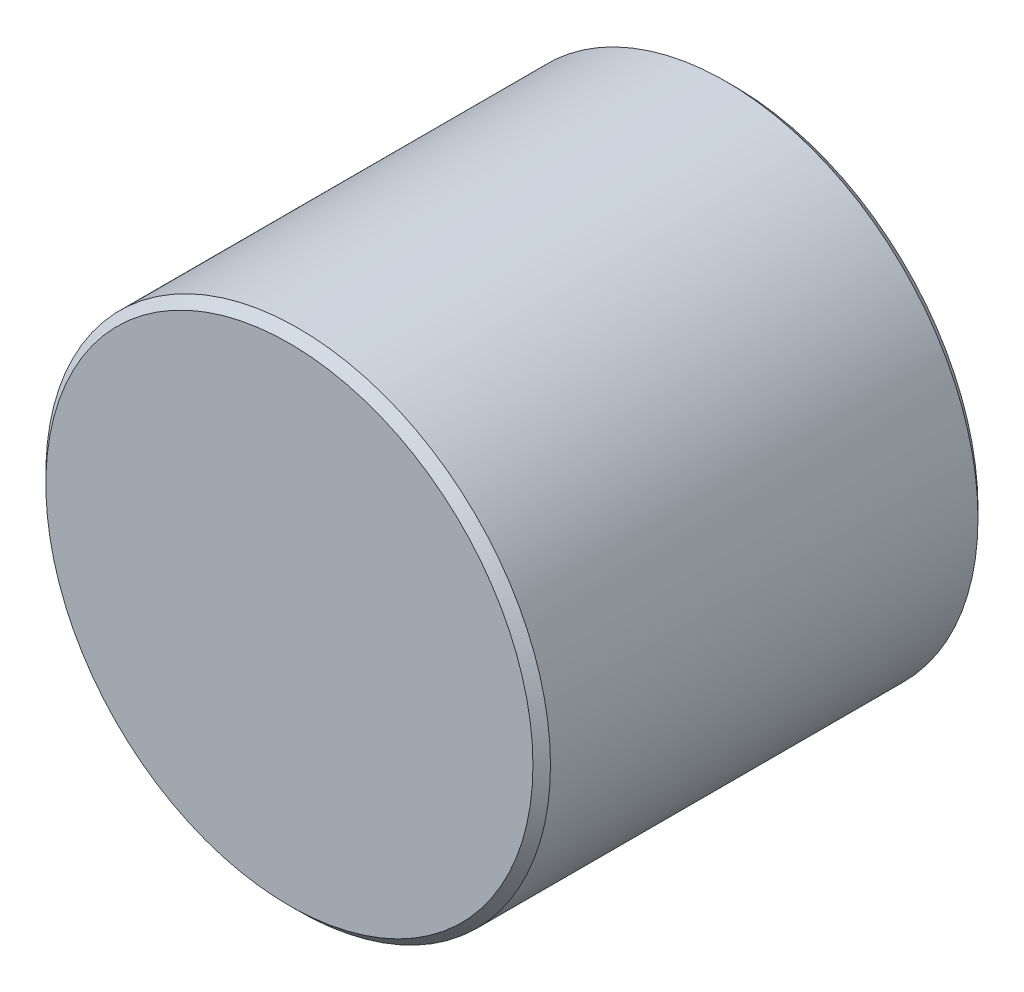
from build123d import *

# Parameters (mm, degrees)
SKETCH1_R           = 7.2
BOSS_EXTRUDE1_DEPTH = 6.35
CHAMFER1_SIZE       = 0.25


with BuildPart() as part:
    # Sketch1 → Boss-Extrude1 (new, symmetric)
    with BuildSketch(Plane.XY):
        Circle(SKETCH1_R)
    extrude(amount=BOSS_EXTRUDE1_DEPTH, both=True)

    # Chamfer1
    chamfer1_edges = [part.edges().sort_by_distance(p)[0] for p in [
        (-7.2, 0, -6.35),
        (-7.2, 0, 6.35),
    ]]
    chamfer(chamfer1_edges, length=CHAMFER1_SIZE)


solid = part.part
